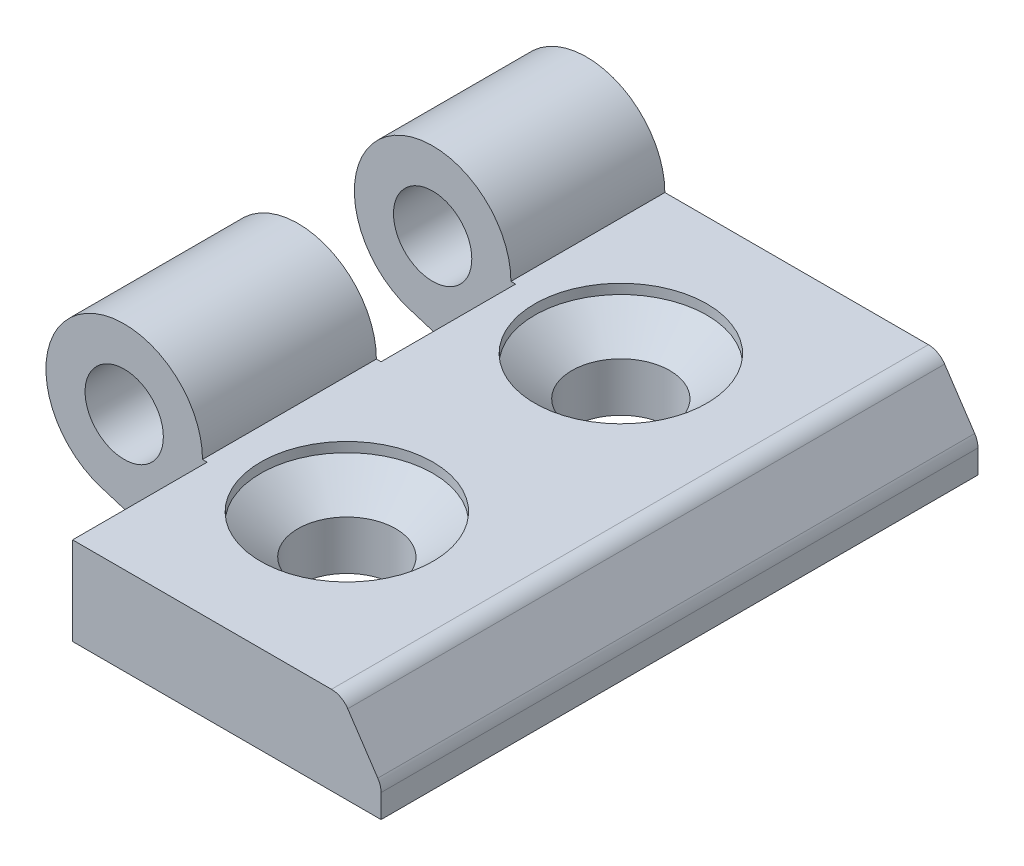
from build123d import *

# Parameters (mm, degrees)
EXTRUDE_1_DEPTH          = 15.25
CUT_EXTRUDE_1_DEPTH      = 26.550195694
CUT_EXTRUDE_1_DEPTH_BACK = 26.550195694
SKETCH_3_W               = 8.238165393
SKETCH_3_H               = 6.875
SKETCH_4_R               = 2
CUT_EXTRUDE_2_DEPTH      = 32.279236324
PATTERN_LINEAR_1_COUNT   = 2
PATTERN_LINEAR_1_PITCH   = 14


with BuildPart() as part:
    # 草图1 → 凸台-拉伸1 (new, symmetric)
    with BuildSketch(Plane.XY):
        with BuildLine():
            Line((17.464816242, 0), (4, 0))
            ThreePointArc((4, 0), (-2.371533507, 3.221153338), (-1.187914412, -3.819536536))
            Line((-1.187914412, -3.819536536), (1, -4.5))
            Line((1, -4.5), (20, -4.5))
            Line((20, -4.5), (20, -3.302775638))
            ThreePointArc((20, -3.302775638), (19.957092026, -3.012991489), (19.832050294, -2.748075442))
            Line((19.832050294, -2.748075442), (18.296866536, -0.445299804))
            ThreePointArc((18.296866536, -0.445299804), (17.936674167, -0.118325401), (17.464816242, 0))
        make_face()
    extrude(amount=EXTRUDE_1_DEPTH, both=True)

    # 草图3 → 切除-拉伸1 (cut, two sides: drawn at the far end of the back side and taken through both)
    with BuildSketch(Plane(origin=(0, 0, 0), x_dir=(1, 0, 0), z_dir=(0, 1, 0)).offset(-CUT_EXTRUDE_1_DEPTH_BACK)):
        with Locations((0.119082697, -11.8125)):
            Rectangle(SKETCH_3_W, SKETCH_3_H)
        with Locations((0.119082697, 3.9475)):
            Rectangle(SKETCH_3_W, SKETCH_3_H)
    extrude(amount=CUT_EXTRUDE_1_DEPTH + CUT_EXTRUDE_1_DEPTH_BACK, mode=Mode.SUBTRACT)

    # 草图4 → 切除-拉伸2 (cut, through all)
    with BuildSketch(Plane.XY.offset(8.375)):
        Circle(SKETCH_4_R)
    extrude(amount=-CUT_EXTRUDE_2_DEPTH, mode=Mode.SUBTRACT)

    # 草图5 → 切除-旋转1 (revolve, cut)
    with BuildSketch(Plane.XY.offset(7), mode=Mode.PRIVATE) as cut_revolve_1_sk:
        Polygon((10, -4.5), (10, 0), (14.4, 0), (14.4, -0.5), (12.5, -2), (12.5, -4.5), align=None)
    cut_revolve_1 = revolve(cut_revolve_1_sk.sketch.rotate(Axis((10, -4.5, 7), (0, 1, 0)), 90), axis=Axis((10, -4.5, 7), (0, 1, 0)), mode=Mode.SUBTRACT)

    # 阵列(线性)1: 切除-旋转1 ×2
    with Locations(*[(0, 0, -i * PATTERN_LINEAR_1_PITCH) for i in range(1, PATTERN_LINEAR_1_COUNT)]):
        add(cut_revolve_1, mode=Mode.SUBTRACT)


solid = part.part
